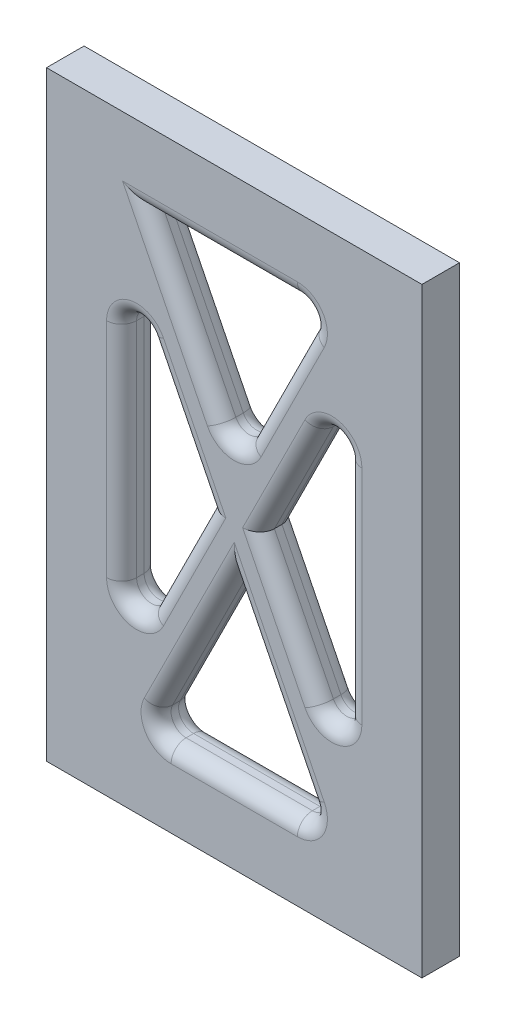
from build123d import *

# Parameters (mm, degrees)
SKETCH1_W           = 50
SKETCH1_H           = 80
BOSS_EXTRUDE1_DEPTH = 5
FILLET1_R           = 2


with BuildPart() as part:
    # Sketch1 → Boss-Extrude1 (new body)
    with BuildSketch(Plane.XY):
        with Locations((25, 40)):
            Rectangle(SKETCH1_W, SKETCH1_H)
        Polygon((10, 16.708203932), (10, 63.291796068), (21.645898034, 40), align=None, mode=Mode.SUBTRACT)
        Polygon((13.354101966, 70), (36.645898034, 70), (25, 46.708203932), align=None, mode=Mode.SUBTRACT)
        Polygon((40, 16.708203932), (40, 63.291796068), (28.354101966, 40), align=None, mode=Mode.SUBTRACT)
        Polygon((13.354101966, 10), (36.645898034, 10), (25, 33.291796068), align=None, mode=Mode.SUBTRACT)
    extrude(amount=BOSS_EXTRUDE1_DEPTH)

    # Fillet1
    fillet1_edges = [part.edges().sort_by_distance(p)[0] for p in [
        (15.822949017, 51.645898034, 0),
        (10, 40, 0),
        (10, 63.291796068, 2.5),
        (15.822949017, 28.354101966, 0),
        (10, 16.708203932, 2.5),
        (15.822949017, 51.645898034, 5),
        (10, 40, 5),
        (15.822949017, 28.354101966, 5),
        (19.177050983, 58.354101966, 0),
        (30.822949017, 58.354101966, 0),
        (25, 46.708203932, 2.5),
        (25, 70, 0),
        (36.645898034, 70, 2.5),
        (19.177050983, 58.354101966, 5),
        (30.822949017, 58.354101966, 5),
        (25, 70, 5),
        (19.177050983, 21.645898034, 0),
        (25, 10, 0),
        (13.354101966, 10, 2.5),
        (30.822949017, 21.645898034, 0),
        (36.645898034, 10, 2.5),
        (19.177050983, 21.645898034, 5),
        (25, 10, 5),
        (30.822949017, 21.645898034, 5),
        (34.177050983, 28.354101966, 0),
        (40, 40, 0),
        (40, 16.708203932, 2.5),
        (34.177050983, 51.645898034, 0),
        (40, 63.291796068, 2.5),
        (34.177050983, 28.354101966, 5),
        (40, 40, 5),
        (34.177050983, 51.645898034, 5),
    ]]
    fillet(fillet1_edges, radius=FILLET1_R)


solid = part.part
